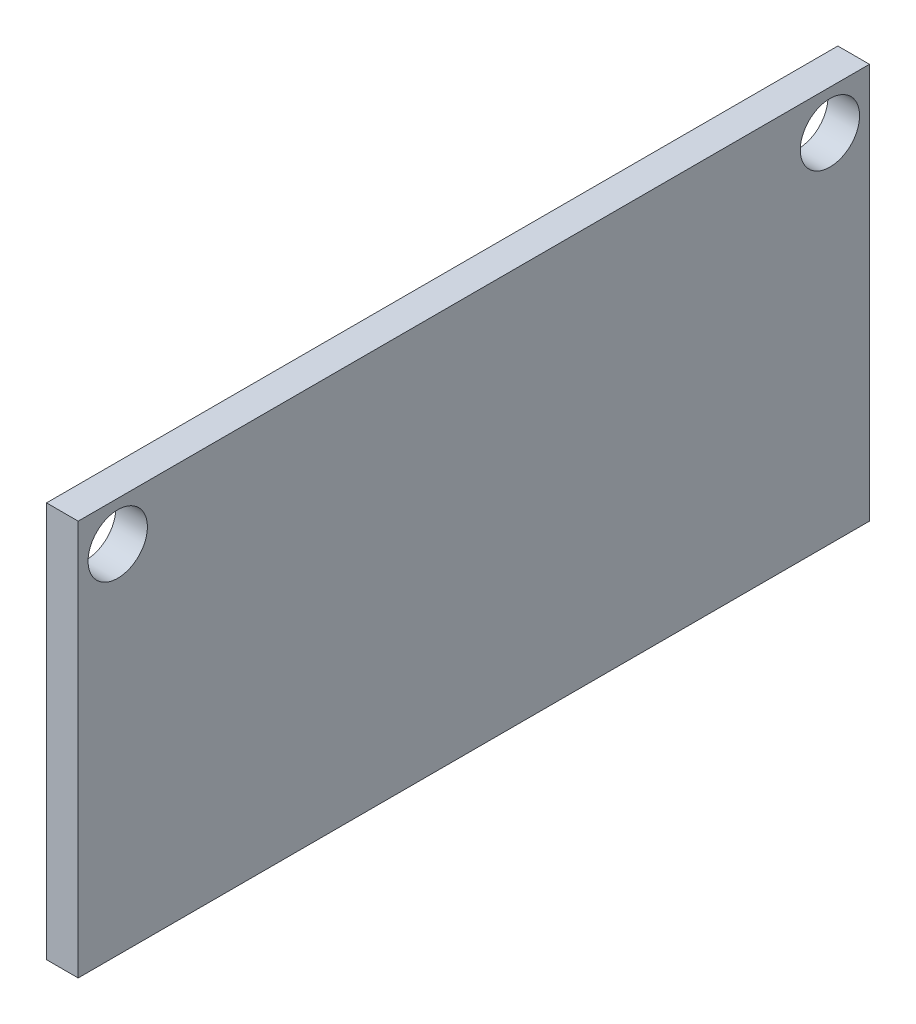
from build123d import *

# Parameters (mm, degrees)
ESQUISSE1_W      = 40
ESQUISSE1_H      = 20
ESQUISSE1_R      = 1.5
EXTRUSION1_DEPTH = 1.6


with BuildPart() as part:
    # Esquisse1 → Extrusion1 (new body)
    with BuildSketch(Plane(origin=(0, 0, 0), x_dir=(0, 0, -1), z_dir=(1, 0, 0))):
        with Locations((0, 10)):
            Rectangle(ESQUISSE1_W, ESQUISSE1_H)
        with Locations((-18, 18)):
            Circle(ESQUISSE1_R, mode=Mode.SUBTRACT)
        with Locations(Location((18, 18, 0), (0, 0, 180))):
            Circle(ESQUISSE1_R, mode=Mode.SUBTRACT)
    extrude(amount=EXTRUSION1_DEPTH)


solid = part.part
